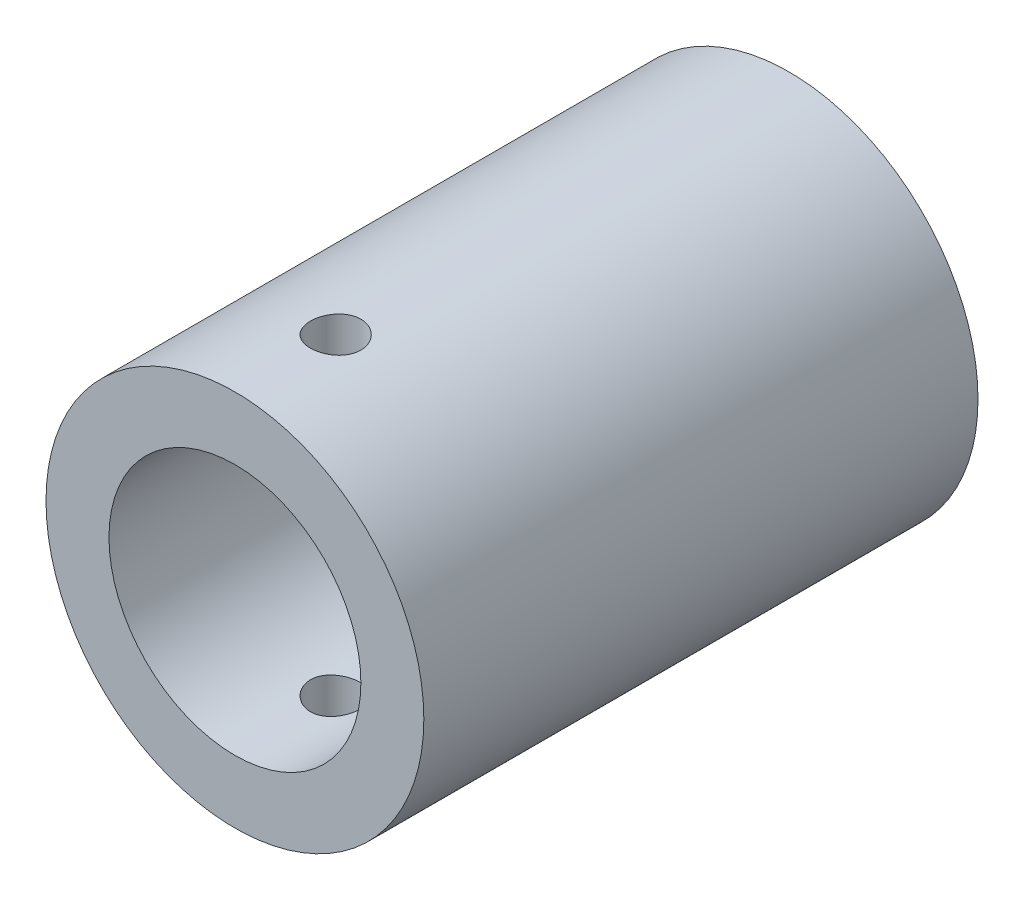
from build123d import *

# Parameters (mm, degrees)
IZIM1_R                     = 15
Y_KSEKLIK_EKSTR_ZYON1_DEPTH = 44
IZIM3_R                     = 10
KES_EKSTR_ZYON1_DEPTH       = 30
IZIM4_R                     = 2
KES_EKSTR_ZYON2_DEPTH       = 60


with BuildPart() as part:
    # Çizim1 → Yükseklik-Ekstrüzyon1 (new body)
    with BuildSketch(Plane.XY):
        Circle(IZIM1_R)
    extrude(amount=Y_KSEKLIK_EKSTR_ZYON1_DEPTH)

    # Çizim3 → Kes-Ekstrüzyon1 (cut)
    with BuildSketch(Plane.XY.offset(44)):
        Circle(IZIM3_R)
    extrude(amount=-KES_EKSTR_ZYON1_DEPTH, mode=Mode.SUBTRACT)

    # Çizim4 → Kes-Ekstrüzyon2 (cut)
    with BuildSketch(Plane(origin=(0, 15, 0), x_dir=(1, 0, 0), z_dir=(0, 1, 0))):
        with Locations(Location((0, -36, 0), (0, 0, 270))):
            Circle(IZIM4_R)
    extrude(amount=-KES_EKSTR_ZYON2_DEPTH, mode=Mode.SUBTRACT)


solid = part.part
